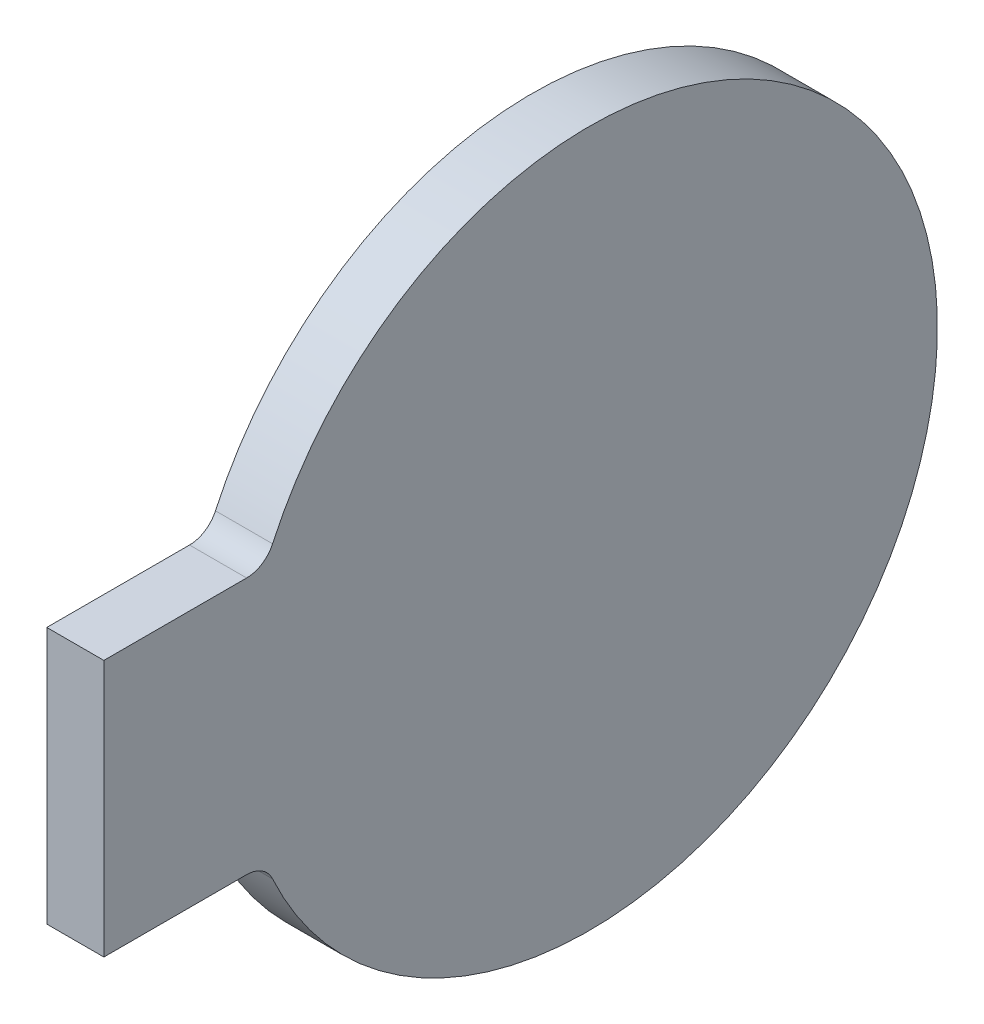
from build123d import *

# Parameters (mm, degrees)
SKETCH_1_W      = 2
SKETCH_1_H      = 12.2
SKETCH_2_W      = 2
SKETCH_2_H      = 9
EXTRUDE_1_DEPTH = 17
FILLET_3_R      = 1


with BuildPart() as part:
    # 草图1 → 旋转1 (revolve)
    with BuildSketch(Plane(origin=(0, 0, 0), x_dir=(1, 0, 0), z_dir=(0, 1, 0)), mode=Mode.PRIVATE) as revolve_1_sk:
        with Locations((-1, -6.1)):
            Rectangle(SKETCH_1_W, SKETCH_1_H)
    revolve(revolve_1_sk.sketch.rotate(Axis((0, 0, 0), (-1, 0, 0)), 180), axis=Axis((0, 0, 0), (-1, 0, 0)))

    # 草图2 → 凸台-拉伸1 (add)
    with BuildSketch(Plane.XY):
        with Locations((-1, 0)):
            Rectangle(SKETCH_2_W, SKETCH_2_H)
    extrude(amount=EXTRUDE_1_DEPTH)

    # 圆角3
    fillet_3_edges = [part.edges().sort_by_distance(p)[0] for p in [
        (-1, -4.5, 11.339753084),
        (-1, 4.5, 11.339753084),
    ]]
    fillet(fillet_3_edges, radius=FILLET_3_R)


solid = part.part
